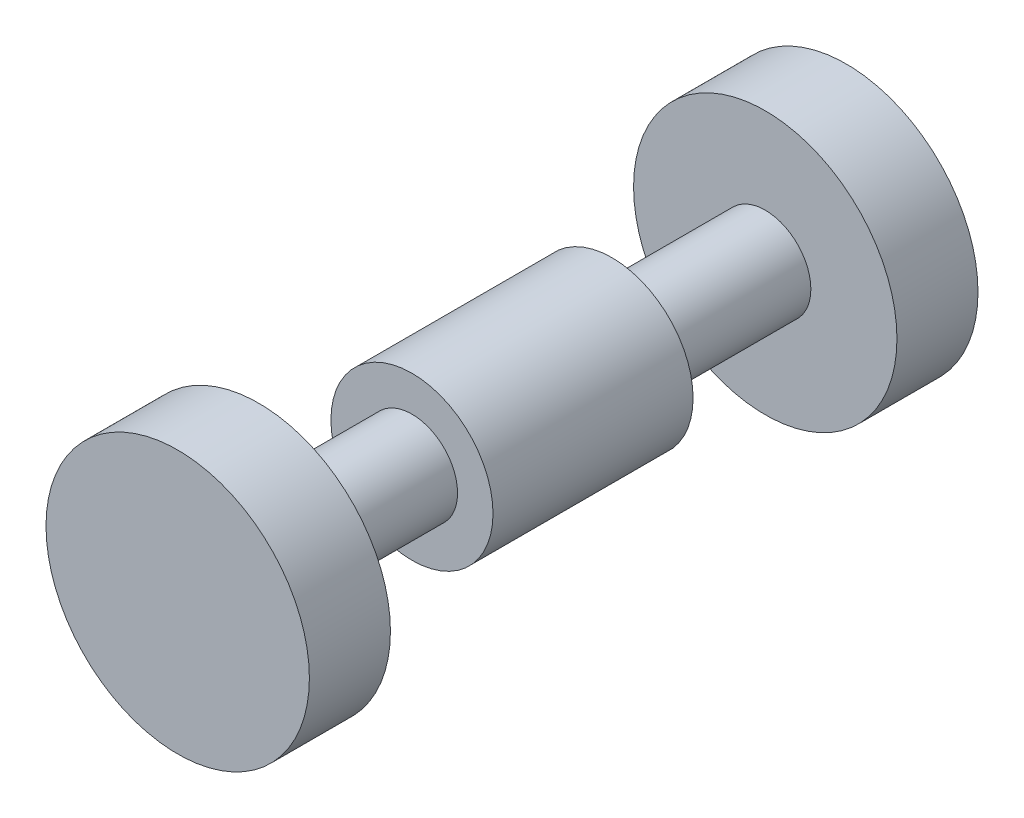
from build123d import *

# Parameters (mm, degrees)
SKETCH1_R           = 0.9
BOSS_EXTRUDE1_DEPTH = 5
SKETCH2_R           = 1.6
BOSS_EXTRUDE2_DEPTH = 1.975
SKETCH3_R           = 2.6
BOSS_EXTRUDE3_DEPTH = 1.6


with BuildPart() as part:
    # Sketch1 → Boss-Extrude1 (new, symmetric)
    with BuildSketch(Plane.XY):
        Circle(SKETCH1_R)
    extrude(amount=BOSS_EXTRUDE1_DEPTH, both=True)

    # Sketch2 → Boss-Extrude2 (add, symmetric)
    with BuildSketch(Plane.XY):
        Circle(SKETCH2_R)
    extrude(amount=BOSS_EXTRUDE2_DEPTH, both=True)

    # Sketch3 → Boss-Extrude3 (add)
    with BuildSketch(Plane.XY.offset(5)):
        Circle(SKETCH3_R)
    boss_extrude3 = extrude(amount=BOSS_EXTRUDE3_DEPTH)

    # Mirror1: Boss-Extrude3 across plane
    add(boss_extrude3.mirror(Plane.XY))


solid = part.part
